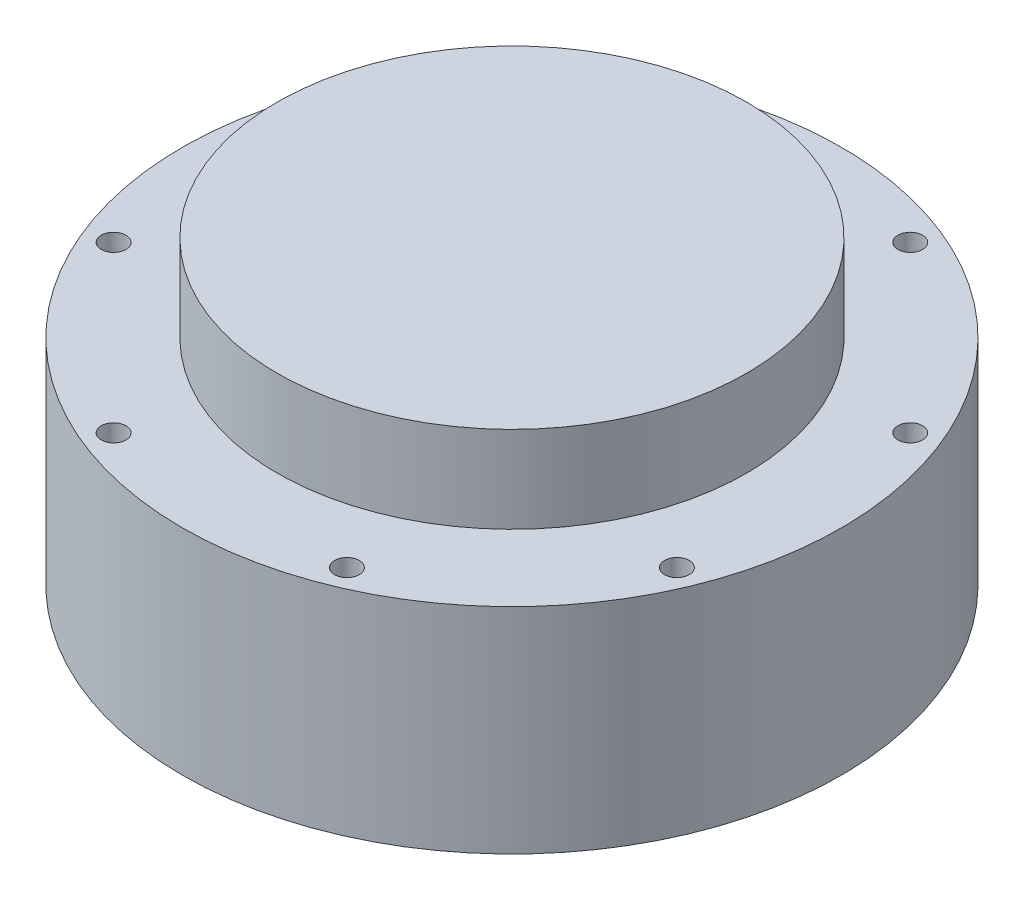
from build123d import *

# Parameters (mm, degrees)
EXTRUDE_1_DEPTH      = 13
EXTRUDE_1_DEPTH_BACK = 13
SKETCH_1_R           = 40
SKETCH_2_R           = 28.5
EXTRUDE_2_DEPTH      = 10.5
SKETCH_3_R           = 23.5
EXTRUDE_3_DEPTH      = 2.8
SKETCH_4_R           = 17
EXTRUDE_4_DEPTH      = 0.7
SKETCH_5_R           = 1.5
CUT_EXTRUDE_1_DEPTH  = 5
CUT_EXTRUDE_START    = 5
SKETCH_6_R           = 1.5
CUT_EXTRUDE_3_DEPTH  = 5
SKETCH_7_R           = 1.5
CUT_EXTRUDE_4_DEPTH  = 5
SKETCH_8_R           = 2
EXTRUDE_5_DEPTH      = 3.5


with BuildPart() as part:
    # 草图1 → 凸台-拉伸1 (new, two sides: drawn at the far end of the back side and taken through both)
    with BuildSketch(Plane(origin=(0, 0, 0), x_dir=(1, 0, 0), z_dir=(0, 1, 0)).offset(-EXTRUDE_1_DEPTH_BACK)):
        Circle(SKETCH_1_R)
    extrude(amount=EXTRUDE_1_DEPTH + EXTRUDE_1_DEPTH_BACK)

    # 草图2 → 凸台-拉伸2 (add)
    with BuildSketch(Plane(origin=(0, 13, 0), x_dir=(1, 0, 0), z_dir=(0, 1, 0))):
        Circle(SKETCH_2_R)
    extrude(amount=EXTRUDE_2_DEPTH)

    # 草图3 → 凸台-拉伸3 (add)
    with BuildSketch(Plane.XZ.offset(13)):
        Circle(SKETCH_3_R)
    extrude(amount=EXTRUDE_3_DEPTH)

    # 草图4 → 凸台-拉伸4 (add)
    with BuildSketch(Plane.XZ.offset(15.8)):
        Circle(SKETCH_4_R)
    extrude(amount=EXTRUDE_4_DEPTH)

    # 草图5 → 切除-拉伸1 (cut)
    with BuildSketch(Plane(origin=(0, 13, 0), x_dir=(1, 0, 0), z_dir=(0, 1, 0))):
        with Locations((14.159286998, 34.183542703)):
            Circle(SKETCH_5_R)
        with Locations((34.183542703, 14.159286998)):
            Circle(SKETCH_5_R)
        with Locations((34.183542703, -14.159286998)):
            Circle(SKETCH_5_R)
        with Locations((14.159286998, -34.183542703)):
            Circle(SKETCH_5_R)
        with Locations((-14.159286998, -34.183542703)):
            Circle(SKETCH_5_R)
        with Locations((-34.183542703, -14.159286998)):
            Circle(SKETCH_5_R)
        with Locations((-34.183542703, 14.159286998)):
            Circle(SKETCH_5_R)
        with Locations((-14.159286998, 34.183542703)):
            Circle(SKETCH_5_R)
    extrude(amount=-CUT_EXTRUDE_1_DEPTH, mode=Mode.SUBTRACT)

    # 草图6 → 切除-拉伸3 (cut)
    with BuildSketch(Plane(origin=(0, -13, -13), x_dir=(1, 0, 0), z_dir=(0, 1, 0)).offset(CUT_EXTRUDE_START)):
        with Locations((14.159286998, 21.183542703)):
            Circle(SKETCH_6_R)
        with Locations((34.183542703, 1.159286998)):
            Circle(SKETCH_6_R)
        with Locations((34.183542703, -27.159286998)):
            Circle(SKETCH_6_R)
        with Locations((14.159286998, -47.183542703)):
            Circle(SKETCH_6_R)
        with Locations((-14.159286998, -47.183542703)):
            Circle(SKETCH_6_R)
        with Locations((-34.183542703, -27.159286998)):
            Circle(SKETCH_6_R)
        with Locations((-34.183542703, 1.159286998)):
            Circle(SKETCH_6_R)
        with Locations((-14.159286998, 21.183542703)):
            Circle(SKETCH_6_R)
    extrude(amount=-CUT_EXTRUDE_3_DEPTH, mode=Mode.SUBTRACT)

    # 草图7 → 切除-拉伸4 (cut)
    with BuildSketch(Plane.XZ.offset(16.5)):
        with Locations((-12.5, 0)):
            Circle(SKETCH_7_R)
        with Locations((-6.25, 10.825317547)):
            Circle(SKETCH_7_R)
        with Locations((-6.25, -10.825317547)):
            Circle(SKETCH_7_R)
        with Locations((6.25, -10.825317547)):
            Circle(SKETCH_7_R)
        with Locations((12.5, 0)):
            Circle(SKETCH_7_R)
        with Locations((6.25, 10.825317547)):
            Circle(SKETCH_7_R)
    extrude(amount=-CUT_EXTRUDE_4_DEPTH, mode=Mode.SUBTRACT)

    # 草图8 → 凸台-拉伸5 (add)
    with BuildSketch(Plane.XZ.offset(16.5)):
        with Locations((0, 10.2)):
            Circle(SKETCH_8_R)
        with Locations((-8.833459119, -5.1)):
            Circle(SKETCH_8_R)
        with Locations((8.833459119, -5.1)):
            Circle(SKETCH_8_R)
    extrude(amount=EXTRUDE_5_DEPTH)


solid = part.part
